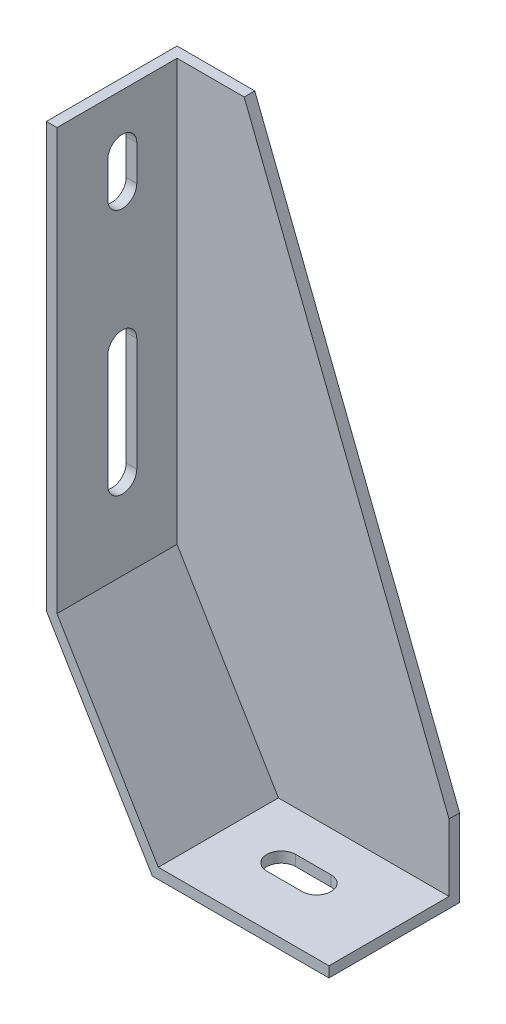
from build123d import *

# Parameters (mm, degrees)
EXTRUDE_1_DEPTH     = 37
EXTRUDE_2_DEPTH     = 3
CUT_EXTRUDE_1_DEPTH = 191.257719948
CUT_EXTRUDE_2_DEPTH = 189.833259782


with BuildPart() as part:
    # 草图1 → 凸台-拉伸1 (new body)
    with BuildSketch(Plane.XY):
        Polygon((0, 3), (-48.301428863, 3), (-77, 50.830951895), (-77, 170), (-80, 170), (-80, 50), (-50, 0), (0, 0), align=None)
    extrude(amount=EXTRUDE_1_DEPTH)

    # 草图3 → 凸台-拉伸2 (add)
    with BuildSketch(Plane(origin=(0, 0, 0), x_dir=(-1, 0, 0), z_dir=(0, 0, -1))):
        Polygon((77, 170), (58, 170), (0, 22), (0, 3), (48.301428863, 3), (77, 50.830951895), align=None)
    extrude(amount=-EXTRUDE_2_DEPTH)

    # 草图4 → 切除-拉伸1 (cut, through all)
    with BuildSketch(Plane(origin=(-77, 0, 0), x_dir=(0, 0, -1), z_dir=(1, 0, 0))):
        with BuildLine():
            Line((-14.4, 155), (-14.4, 145))
            ThreePointArc((-14.4, 145), (-18.5, 140.9), (-22.6, 145))
            Line((-22.6, 145), (-22.6, 155))
            ThreePointArc((-22.6, 155), (-18.5, 159.1), (-14.4, 155))
        make_face()
        with BuildLine():
            Line((-14.4, 107), (-14.4, 75))
            ThreePointArc((-14.4, 75), (-18.5, 70.9), (-22.6, 75))
            Line((-22.6, 75), (-22.6, 107))
            ThreePointArc((-22.6, 107), (-18.5, 111.1), (-14.4, 107))
        make_face()
    extrude(amount=-CUT_EXTRUDE_1_DEPTH, mode=Mode.SUBTRACT)

    # 草图5 → 切除-拉伸2 (cut, through all)
    with BuildSketch(Plane(origin=(0, 3, 0), x_dir=(1, 0, 0), z_dir=(0, 1, 0))):
        with BuildLine():
            Line((-22, -22.6), (-32, -22.6))
            ThreePointArc((-32, -22.6), (-36.1, -18.5), (-32, -14.4))
            Line((-32, -14.4), (-22, -14.4))
            ThreePointArc((-22, -14.4), (-17.9, -18.5), (-22, -22.6))
        make_face()
    extrude(amount=-CUT_EXTRUDE_2_DEPTH, mode=Mode.SUBTRACT)


solid = part.part
